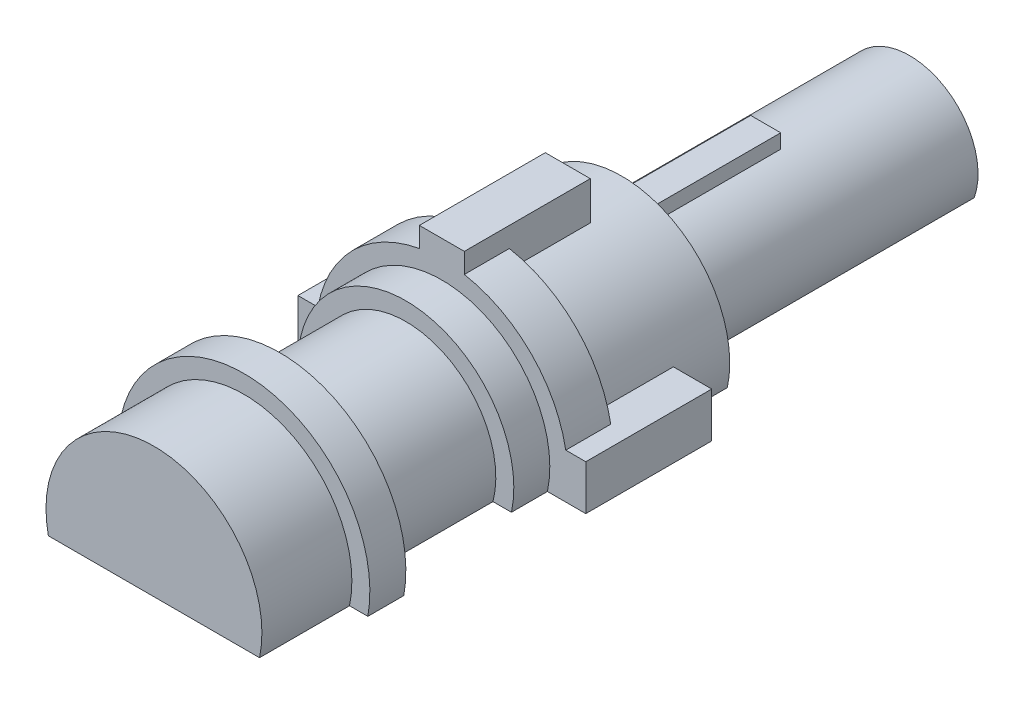
from build123d import *
from build123d.topology import SkipClean

# Parameters (mm, degrees)
BOSS_EXTRUDE1_DEPTH = 7
BOSS_EXTRUDE2_DEPTH = 16
BOSS_EXTRUDE3_START = -16
BOSS_EXTRUDE3_DEPTH = 2.5
BOSS_EXTRUDE4_START = -5
BOSS_EXTRUDE4_DEPTH = 2.5
CUT_EXTRUDE1_START  = -7
SKETCH7_R           = 7.581765893
CUT_EXTRUDE1_DEPTH  = 7
BOSS_EXTRUDE5_START = 3
BOSS_EXTRUDE5_DEPTH = 3
BOSS_EXTRUDE6_DEPTH = 8
BOSS_EXTRUDE7_DEPTH = 8


with BuildPart() as part:
    # Sketch1 → Boss-Extrude1 (new body)
    with BuildSketch(Plane.XY):
        with BuildLine():
            Line((8, 1.25), (5.868347297, 1.25))
            ThreePointArc((5.868347297, 1.25), (4.242640687, 4.242640687), (1.25, 5.868347297))
            Line((1.25, 5.868347297), (1.25, 8))
            Line((1.25, 8), (-1.25, 8))
            Line((-1.25, 8), (-1.25, 5.868347297))
            ThreePointArc((-1.25, 5.868347297), (-4.242640687, 4.242640687), (-5.868347297, 1.25))
            Line((-5.868347297, 1.25), (-8, 1.25))
            Line((-8, 1.25), (-8, -1.25))
            Line((-8, -1.25), (8, -1.25))
            Line((8, -1.25), (8, 1.25))
        make_face()
    extrude(amount=BOSS_EXTRUDE1_DEPTH)

    # Sketch3 → Boss-Extrude2 (add)
    with BuildSketch(Plane.XY.offset(7)):
        with BuildLine():
            Line((-5.868347297, -1.25), (5.868347297, -1.25))
            ThreePointArc((5.868347297, -1.25), (0, 6), (-5.868347297, -1.25))
        make_face()
    extrude(amount=BOSS_EXTRUDE2_DEPTH)

    # Sketch5 → Boss-Extrude3 (add)
    with BuildSketch(Plane.XY.offset(23).offset(BOSS_EXTRUDE3_START)):
        with BuildLine():
            Line((-6.887488657, -1.25), (6.887488657, -1.25))
            ThreePointArc((6.887488657, -1.25), (0, 7), (-6.887488657, -1.25))
        make_face()
    extrude(amount=-BOSS_EXTRUDE3_DEPTH)

    # Sketch6 → Boss-Extrude4 (add)
    with BuildSketch(Plane.XY.offset(23).offset(BOSS_EXTRUDE4_START)):
        with BuildLine():
            Line((-6.887488657, -1.25), (6.887488657, -1.25))
            ThreePointArc((6.887488657, -1.25), (0, 7), (-6.887488657, -1.25))
        make_face()
    extrude(amount=-BOSS_EXTRUDE4_DEPTH)

    # Sketch7 → Cut-Extrude1 (cut)
    with BuildSketch(Plane.XY.offset(23).offset(CUT_EXTRUDE1_START)):
        Circle(SKETCH7_R)
        with BuildLine():
            Line((-4.841229183, -1.25), (4.841229183, -1.25))
            ThreePointArc((4.841229183, -1.25), (0, 5), (-4.841229183, -1.25))
        make_face(mode=Mode.SUBTRACT)
    extrude(amount=-CUT_EXTRUDE1_DEPTH, mode=Mode.SUBTRACT)

    # Sketch8 → Boss-Extrude5 (add)
    with SkipClean():  # the faces are left unmerged after this step: merging them gives an invalid solid
        with BuildSketch(Plane(origin=(0, 0, 0), x_dir=(-1, 0, 0), z_dir=(0, 0, -1)).offset(BOSS_EXTRUDE5_START)):
            with BuildLine():
                Line((-5.868347297, -1.25), (5.868347297, -1.25))
                ThreePointArc((5.868347297, -1.25), (0, 6), (-5.868347297, -1.25))
            make_face()
        extrude(amount=-BOSS_EXTRUDE5_DEPTH)

    # Sketch9 → Boss-Extrude6 (add)
    with SkipClean():  # the faces are left unmerged after this step: merging them gives an invalid solid
        with BuildSketch(Plane(origin=(0, 0, -3), x_dir=(-1, 0, 0), z_dir=(0, 0, -1))):
            with BuildLine():
                Line((-3.588523373, -1.25), (3.588523373, -1.25))
                ThreePointArc((3.588523373, -1.25), (3.321506513, 1.845967087), (0.833333333, 3.707499906))
                Line((0.833333333, 3.707499906), (0.833333333, 4.5))
                Line((0.833333333, 4.5), (-0.833333333, 4.5))
                Line((-0.833333333, 4.5), (-0.833333333, 3.707499906))
                ThreePointArc((-0.833333333, 3.707499906), (-3.321506513, 1.845967087), (-3.588523373, -1.25))
            make_face()
        extrude(amount=BOSS_EXTRUDE6_DEPTH)

    # Sketch10 → Boss-Extrude7 (add)
    with SkipClean():  # the faces are left unmerged after this step: merging them gives an invalid solid
        with BuildSketch(Plane(origin=(0, 0, -11), x_dir=(-1, 0, 0), z_dir=(0, 0, -1))):
            with BuildLine():
                Line((-3.588523373, -1.25), (3.588523373, -1.25))
                ThreePointArc((3.588523373, -1.25), (0, 3.8), (-3.588523373, -1.25))
            make_face()
        extrude(amount=BOSS_EXTRUDE7_DEPTH)


solid = part.part
